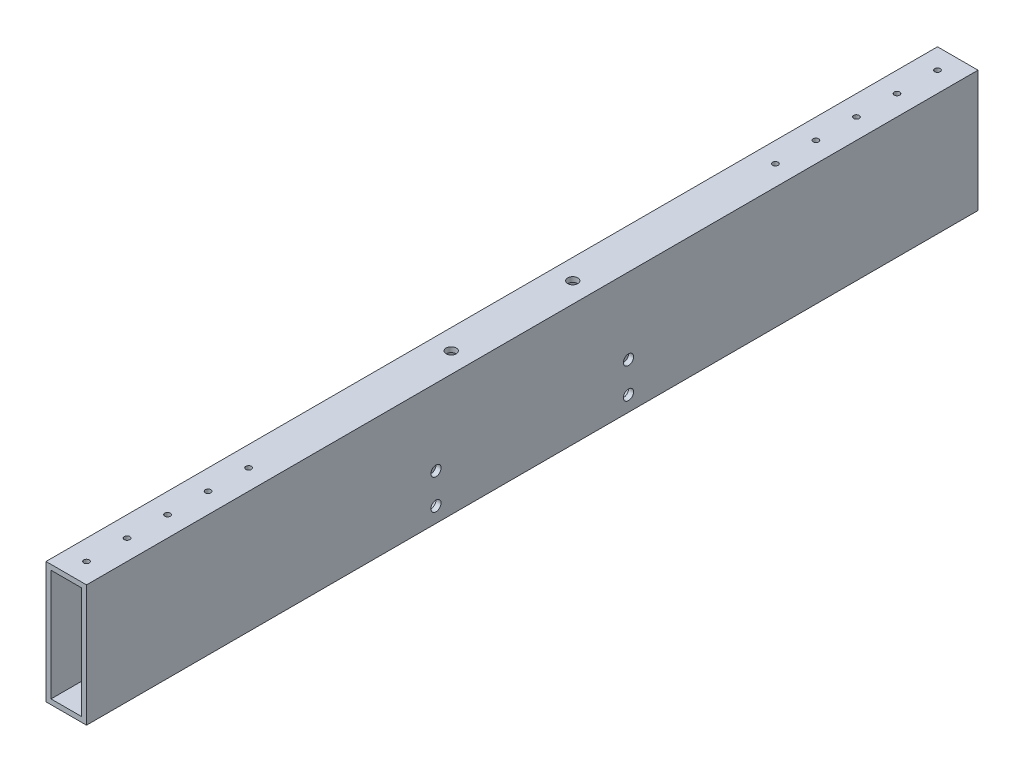
from build123d import *

# Parameters (mm, degrees)
SKETCH1_W                       = 25.4
SKETCH1_H                       = 76.2
SKETCH1_W_2                     = 19.05
SKETCH1_H_2                     = 69.85
BOSS_EXTRUDE1_DEPTH             = 279.4
SKETCH3_R                       = 1.7272
CUT_EXTRUDE2_DEPTH              = 6.35
F_1_4_0_25_DIAMETER_HOLE1_D     = 6.35
F_1_4_0_25_DIAMETER_HOLE1_DEPTH = 25.4
F_1_4_0_25_DIAMETER_HOLE1_TIP   = 1.907732465
F_1_4_0_25_DIAMETER_HOLE2_D     = 6.35
SKETCH2_R                       = 1.7272
CUT_EXTRUDE4_DEPTH              = 6.35


with BuildPart() as part:
    # Sketch1 → Boss-Extrude1 (new, symmetric)
    with BuildSketch(Plane.XY):
        Rectangle(SKETCH1_W, SKETCH1_H)
        Rectangle(SKETCH1_W_2, SKETCH1_H_2, mode=Mode.SUBTRACT)
    extrude(amount=BOSS_EXTRUDE1_DEPTH, both=True)

    # Sketch3 → Cut-Extrude2 (cut)
    with BuildSketch(Plane.XZ.offset(38.1)):
        with Locations(Location((0, 254, 0), (0, 0, 270))):
            Circle(SKETCH3_R)
        with Locations(Location((0, 203.2, 0), (0, 0, 270))):
            Circle(SKETCH3_R)
        with Locations(Location((0, 152.4, 0), (0, 0, 270))):
            Circle(SKETCH3_R)
        with Locations(Location((0, 101.6, 0), (0, 0, 270))):
            Circle(SKETCH3_R)
        with Locations(Location((0, 50.8, 0), (0, 0, 270))):
            Circle(SKETCH3_R)
        with Locations(Location((0, 0, 0), (0, 0, 270))):
            Circle(SKETCH3_R)
        with Locations(Location((0, -50.8, 0), (0, 0, 270))):
            Circle(SKETCH3_R)
        with Locations(Location((0, -101.6, 0), (0, 0, 270))):
            Circle(SKETCH3_R)
        with Locations(Location((0, -152.4, 0), (0, 0, 270))):
            Circle(SKETCH3_R)
        with Locations(Location((0, -203.2, 0), (0, 0, 270))):
            Circle(SKETCH3_R)
        with Locations(Location((0, -254, 0), (0, 0, 270))):
            Circle(SKETCH3_R)
    extrude(amount=-CUT_EXTRUDE2_DEPTH, mode=Mode.SUBTRACT)

    # 1/4 (0.25) Diameter Hole1
    with Locations(Plane.ZY.offset(12.7)):
        with Locations((-60.325, -28.575), (60.325, -28.575), (-60.325, -9.525), (60.325, -9.525)):
            Hole(F_1_4_0_25_DIAMETER_HOLE1_D / 2, depth=F_1_4_0_25_DIAMETER_HOLE1_DEPTH)
            with Locations((0, 0, -(F_1_4_0_25_DIAMETER_HOLE1_DEPTH + F_1_4_0_25_DIAMETER_HOLE1_TIP / 2))):  # 118° drill point
                Cone(0, F_1_4_0_25_DIAMETER_HOLE1_D / 2, F_1_4_0_25_DIAMETER_HOLE1_TIP, mode=Mode.SUBTRACT)

    # 1/4 (0.25) Diameter Hole2 (through all)
    with Locations(Plane(origin=(0, 38.1, 0), x_dir=(1, 0, 0), z_dir=(0, 1, 0))):
        with Locations((0, -38.1), (0, 38.1)):
            Hole(F_1_4_0_25_DIAMETER_HOLE2_D / 2)

    # Sketch2 → Cut-Extrude4 (cut)
    with BuildSketch(Plane(origin=(0, 38.1, 0), x_dir=(1, 0, 0), z_dir=(0, 1, 0))):
        with Locations(Location((0, 266.7, 0), (0, 0, 270))):
            Circle(SKETCH2_R)
        with Locations(Location((0, 241.3, 0), (0, 0, 270))):
            Circle(SKETCH2_R)
        with Locations(Location((0, 215.9, 0), (0, 0, 270))):
            Circle(SKETCH2_R)
        with Locations(Location((0, 190.5, 0), (0, 0, 270))):
            Circle(SKETCH2_R)
        with Locations(Location((0, 165.1, 0), (0, 0, 270))):
            Circle(SKETCH2_R)
    cut_extrude4 = extrude(amount=-CUT_EXTRUDE4_DEPTH, mode=Mode.SUBTRACT)

    # Mirror1: Cut-Extrude4 across plane
    add(cut_extrude4.mirror(Plane.XY), mode=Mode.SUBTRACT)


solid = part.part
